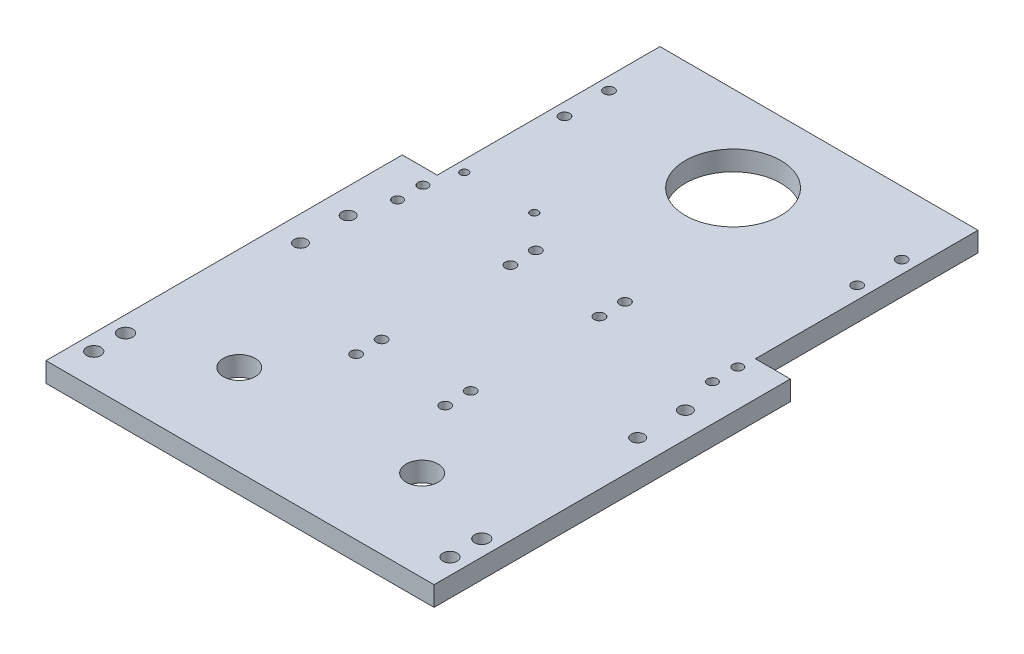
from build123d import *

# Parameters (mm, degrees)
SKETCH1_W           = 122
SKETCH1_H           = 112
BOSS_EXTRUDE1_DEPTH = 6.2
SKETCH2_W           = 100
SKETCH2_H           = 70
BOSS_EXTRUDE2_DEPTH = 6.2
SKETCH3_R           = 1.25
SKETCH3_R_2         = 1.65
SKETCH3_R_3         = 15
CUT_EXTRUDE1_DEPTH  = 141.126514265
SKETCH4_R           = 1.55
SKETCH4_R_2         = 1.65
CUT_EXTRUDE2_DEPTH  = 141.126514265
SKETCH5_R           = 2
CUT_EXTRUDE3_DEPTH  = 10
SKETCH6_R           = 5
CUT_EXTRUDE4_DEPTH  = 10
SKETCH7_R           = 2.25
CUT_EXTRUDE5_DEPTH  = 141.126514265


with BuildPart() as part:
    # Sketch1 → Boss-Extrude1 (new body)
    with BuildSketch(Plane(origin=(0, 0, 0), x_dir=(1, 0, 0), z_dir=(0, 1, 0))):
        Rectangle(SKETCH1_W, SKETCH1_H)
    extrude(amount=BOSS_EXTRUDE1_DEPTH)

    # Sketch2 → Boss-Extrude2 (add)
    with BuildSketch(Plane(origin=(0, 0, 0), x_dir=(1, 0, 0), z_dir=(0, 1, 0))):
        with Locations((0, 91)):
            Rectangle(SKETCH2_W, SKETCH2_H)
    extrude(amount=BOSS_EXTRUDE2_DEPTH)

    # Sketch3 → Cut-Extrude1 (cut, through all)
    with BuildSketch(Plane(origin=(0, 6.2, 0), x_dir=(1, 0, 0), z_dir=(0, 1, 0))):
        with Locations(Location((-46.5, 61, 0), (0, 0, 270))):
            Circle(SKETCH3_R)
        with Locations(Location((-24.5, 61, 0), (0, 0, 270))):
            Circle(SKETCH3_R)
        with Locations(Location((-46.013, 106, 0), (0, 0, 270))):
            Circle(SKETCH3_R_2)
        with Locations(Location((0, 99, 0), (0, 0, 270))):
            Circle(SKETCH3_R_3)
        with Locations(Location((-46.013, 92, 0), (0, 0, 270))):
            Circle(SKETCH3_R_2)
        with Locations(Location((46.013, 92, 0), (0, 0, 270))):
            Circle(SKETCH3_R_2)
        with Locations(Location((46.013, 106, 0), (0, 0, 270))):
            Circle(SKETCH3_R_2)
    extrude(amount=-CUT_EXTRUDE1_DEPTH, mode=Mode.SUBTRACT)

    # Sketch4 → Cut-Extrude2 (cut, through all)
    with BuildSketch(Plane(origin=(0, 6.2, 0), x_dir=(1, 0, 0), z_dir=(0, 1, 0))):
        with Locations(Location((-49.5, 51, 0), (0, 0, 270))):
            Circle(SKETCH4_R)
        with Locations(Location((-49.5, 43, 0), (0, 0, 270))):
            Circle(SKETCH4_R)
        with Locations(Location((-14, 2.5, 0), (0, 0, 270))):
            Circle(SKETCH4_R_2)
        with Locations(Location((14, 2.5, 0), (0, 0, 270))):
            Circle(SKETCH4_R_2)
        with Locations(Location((14, -5.5, 0), (0, 0, 270))):
            Circle(SKETCH4_R_2)
        with Locations(Location((-14, -5.5, 0), (0, 0, 270))):
            Circle(SKETCH4_R_2)
        with Locations(Location((-14, 51, 0), (0, 0, 270))):
            Circle(SKETCH4_R_2)
        with Locations(Location((14, 51, 0), (0, 0, 270))):
            Circle(SKETCH4_R_2)
        with Locations(Location((14, 43, 0), (0, 0, 270))):
            Circle(SKETCH4_R_2)
        with Locations(Location((-14, 43, 0), (0, 0, 270))):
            Circle(SKETCH4_R_2)
        with Locations(Location((49.5, 43, 0), (0, 0, 270))):
            Circle(SKETCH4_R)
        with Locations(Location((49.5, 51, 0), (0, 0, 270))):
            Circle(SKETCH4_R)
    extrude(amount=-CUT_EXTRUDE2_DEPTH, mode=Mode.SUBTRACT)

    # Sketch5 → Cut-Extrude3 (cut)
    with BuildSketch(Plane(origin=(0, 6.2, 0), x_dir=(1, 0, 0), z_dir=(0, 1, 0))):
        with Locations(Location((-53, 31, 0), (0, 0, 270))):
            Circle(SKETCH5_R)
        with Locations(Location((-53, 16, 0), (0, 0, 270))):
            Circle(SKETCH5_R)
        with Locations(Location((53, 16, 0), (0, 0, 270))):
            Circle(SKETCH5_R)
        with Locations(Location((53, 31, 0), (0, 0, 270))):
            Circle(SKETCH5_R)
    extrude(amount=-CUT_EXTRUDE3_DEPTH, mode=Mode.SUBTRACT)

    # Sketch6 → Cut-Extrude4 (cut)
    with BuildSketch(Plane(origin=(0, 6.2, 0), x_dir=(1, 0, 0), z_dir=(0, 1, 0))):
        with Locations(Location((-28.75, -27.5, 0), (0, 0, 270))):
            Circle(SKETCH6_R)
        with Locations(Location((28.75, -27.5, 0), (0, 0, 270))):
            Circle(SKETCH6_R)
    extrude(amount=-CUT_EXTRUDE4_DEPTH, mode=Mode.SUBTRACT)

    # Sketch7 → Cut-Extrude5 (cut, through all)
    with BuildSketch(Plane(origin=(0, 6.2, 0), x_dir=(1, 0, 0), z_dir=(0, 1, 0))):
        with Locations(Location((-56, -36, 0), (0, 0, 270))):
            Circle(SKETCH7_R)
        with Locations(Location((-56, -46, 0), (0, 0, 270))):
            Circle(SKETCH7_R)
        with Locations(Location((56, -46, 0), (0, 0, 270))):
            Circle(SKETCH7_R)
        with Locations(Location((56, -36, 0), (0, 0, 270))):
            Circle(SKETCH7_R)
    extrude(amount=-CUT_EXTRUDE5_DEPTH, mode=Mode.SUBTRACT)


solid = part.part
